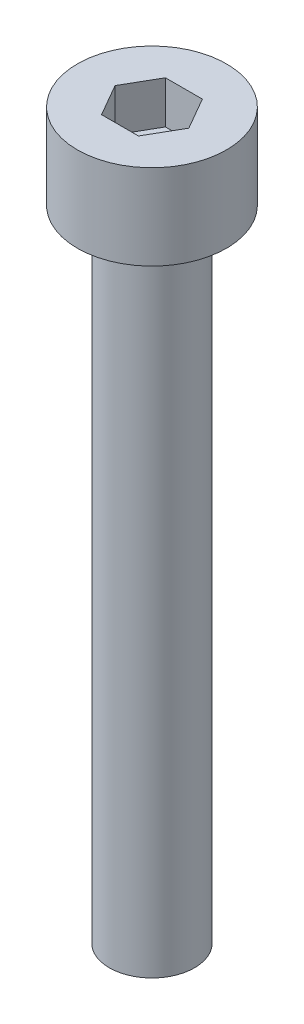
from build123d import *

# Parameters (mm, degrees)
CUT_EXTRUDE1_DEPTH = 2


with BuildPart() as part:
    # Sketch1 → Revolve1 (revolve)
    with BuildSketch(Plane.XY, mode=Mode.PRIVATE) as revolve1_sk:
        Polygon((0, 0), (0, -30), (2, -30), (2, 0), (3.5, 0), (3.5, 4), (0, 4), align=None)
    revolve(revolve1_sk.sketch.rotate(Axis((0, 0, 0), (0, -1, 0)), 90), axis=Axis((0, 0, 0), (0, -1, 0)))

    # Sketch2 → Cut-Extrude1 (cut)
    with BuildSketch(Plane(origin=(0, 4, 0), x_dir=(1, 0, 0), z_dir=(0, 1, 0))):
        Polygon((1.732050808, 0), (0.866025404, 1.5), (-0.866025404, 1.5), (-1.732050808, 0), (-0.866025404, -1.5), (0.866025404, -1.5), align=None)
    extrude(amount=-CUT_EXTRUDE1_DEPTH, mode=Mode.SUBTRACT)


solid = part.part
